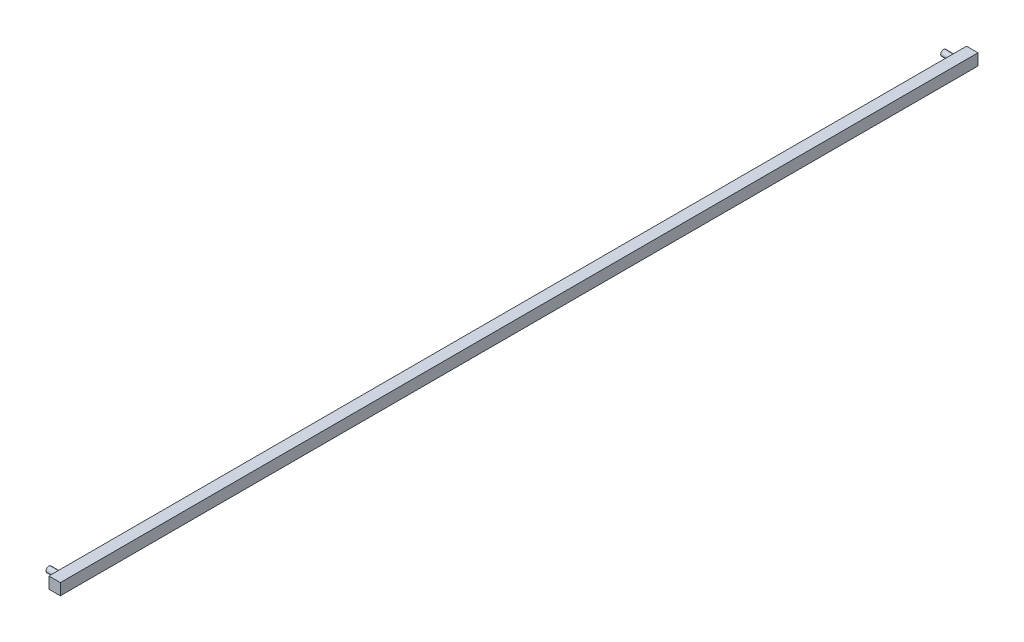
from build123d import *

# Parameters (mm, degrees)
SKETCH1_W           = 10
SKETCH1_H           = 10
BOSS_EXTRUDE1_DEPTH = 800
SKETCH4_R           = 2.5
BOSS_EXTRUDE3_DEPTH = 10


with BuildPart() as part:
    # Sketch1 → Boss-Extrude1 (new body)
    with BuildSketch(Plane.XY):
        Rectangle(SKETCH1_W, SKETCH1_H)
    extrude(amount=BOSS_EXTRUDE1_DEPTH)

    # Sketch4 → Boss-Extrude3 (add)
    with BuildSketch(Plane.ZY.offset(5)):
        with Locations(Location((10, 0, 0), (0, 0, 180))):
            Circle(SKETCH4_R)
        with Locations(Location((790, 0, 0), (0, 0, 180))):
            Circle(SKETCH4_R)
    extrude(amount=BOSS_EXTRUDE3_DEPTH)


solid = part.part
